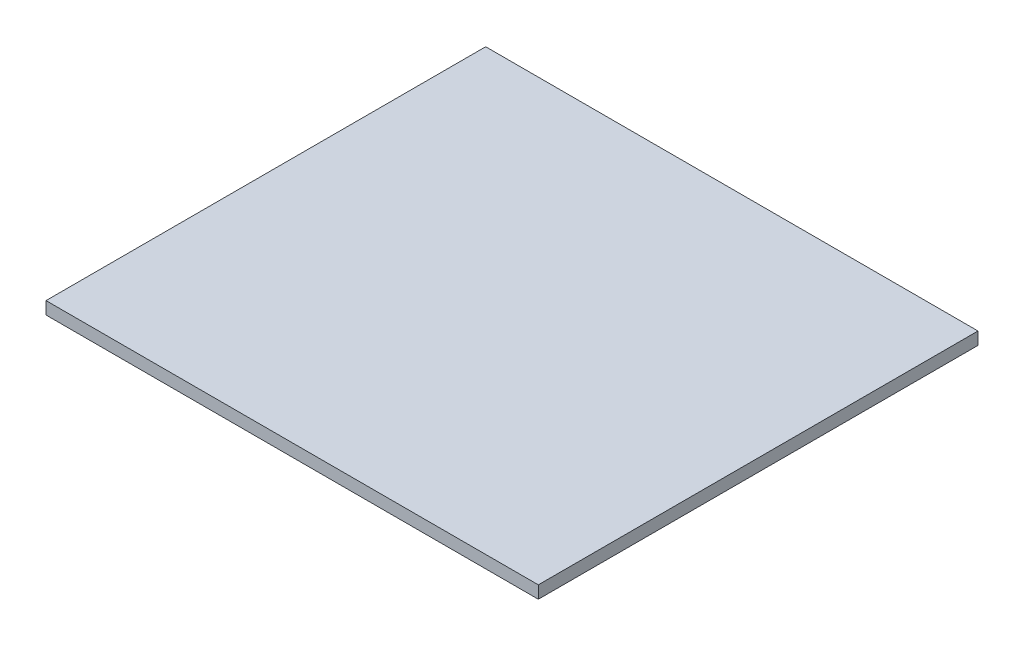
from build123d import *

# Parameters (mm, degrees)
SKETCH1_W           = 375
SKETCH1_H           = 334.9
BOSS_EXTRUDE1_DEPTH = 9.525


with BuildPart() as part:
    # Sketch1 → Boss-Extrude1 (new body)
    with BuildSketch(Plane(origin=(0, 0, 0), x_dir=(1, 0, 0), z_dir=(0, 1, 0))):
        with Locations((187.5, 167.45)):
            Rectangle(SKETCH1_W, SKETCH1_H)
    extrude(amount=BOSS_EXTRUDE1_DEPTH)


solid = part.part
